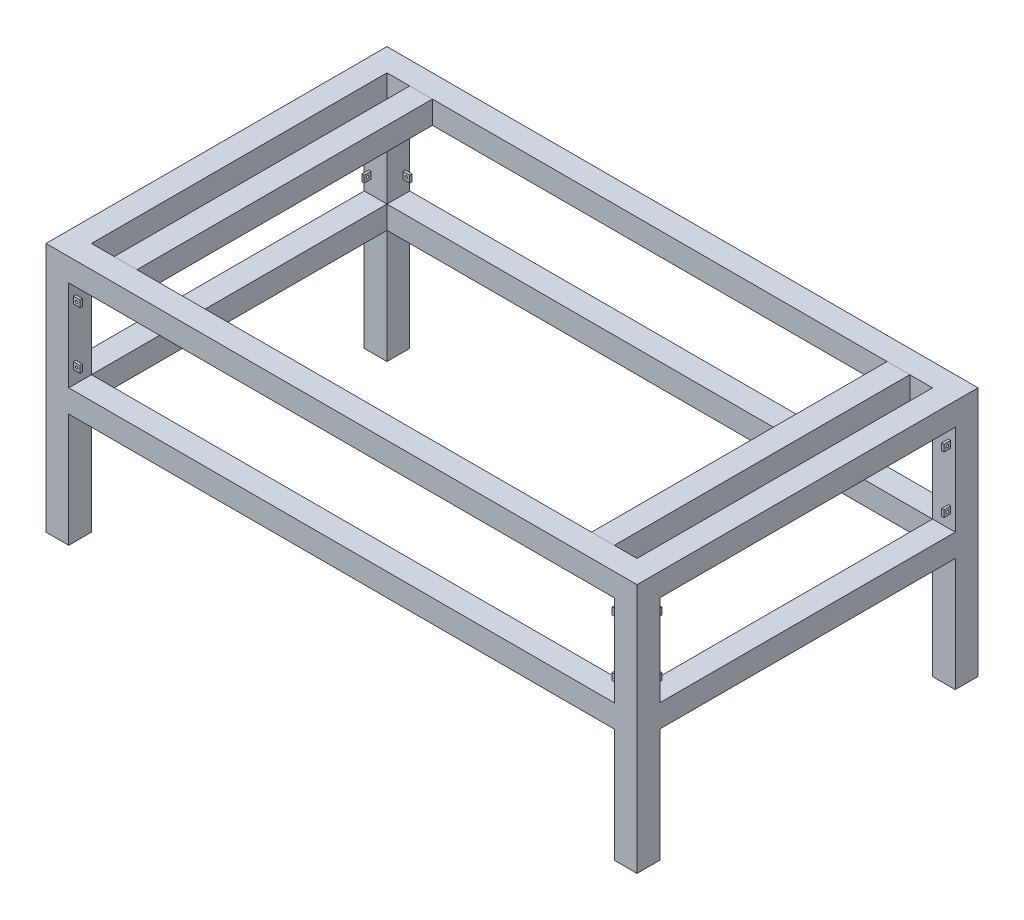
from build123d import *

# Parameters (mm, degrees)
ESQUISSE1_W             = 1300
ESQUISSE1_H             = 750
ESQUISSE1_W_2           = 1200
ESQUISSE1_H_2           = 650
BOSS_EXTRU_1_DEPTH      = 550
ESQUISSE2_W             = 1200
ESQUISSE2_H             = 200
ESQUISSE2_H_2           = 250
ENL_V_MAT_EXTRU_1_DEPTH = 1599.436736315
ESQUISSE3_W             = 650
ESQUISSE3_H             = 200
ESQUISSE3_H_2           = 250
ENL_V_MAT_EXTRU_2_DEPTH = 1599.436736315
ESQUISSE4_W             = 50
ESQUISSE4_H             = 650
BOSS_EXTRU_2_DEPTH      = 50
BOSS_EXTRU_2_2_DEPTH    = 50
ESQUISSE5_W             = 5
ESQUISSE5_H             = 15
BOSS_EXTRU_3_DEPTH      = 15
ESQUISSE6_W             = 5
ESQUISSE6_H             = 15
BOSS_EXTRU_4_DEPTH      = 15
ESQUISSE7_W             = 5
ESQUISSE7_H             = 15
BOSS_EXTRU_5_DEPTH      = 15
ESQUISSE8_W             = 5
ESQUISSE8_H             = 15
BOSS_EXTRU_6_DEPTH      = 15
ESQUISSE10_W            = 5
ESQUISSE10_H            = 15
BOSS_EXTRU_7_DEPTH      = 15
ESQUISSE12_W            = 5
ESQUISSE12_H            = 15
BOSS_EXTRU_8_DEPTH      = 15
ESQUISSE14_W            = 5
ESQUISSE14_H            = 15
BOSS_EXTRU_9_DEPTH      = 15
ESQUISSE15_W            = 5
ESQUISSE15_H            = 15
BOSS_EXTRU_10_DEPTH     = 15
ESQUISSE16_R            = 2.75
ENL_V_MAT_EXTRU_3_DEPTH = 1500
ESQUISSE17_R            = 2.75
ENL_V_MAT_EXTRU_4_DEPTH = 1000


with BuildPart() as part:
    # Esquisse1 → Boss.-Extru.1 (new body)
    with BuildSketch(Plane(origin=(0, 0, 0), x_dir=(1, 0, 0), z_dir=(0, 1, 0))):
        with Locations((650, 375)):
            Rectangle(ESQUISSE1_W, ESQUISSE1_H)
        with Locations((650, 375)):
            Rectangle(ESQUISSE1_W_2, ESQUISSE1_H_2, mode=Mode.SUBTRACT)
    extrude(amount=-BOSS_EXTRU_1_DEPTH)

    # Esquisse2 → Enlèv. mat.-Extru.1 (cut, through all)
    with BuildSketch(Plane.XY):
        with Locations((650, -150)):
            Rectangle(ESQUISSE2_W, ESQUISSE2_H)
        with Locations((650, -425)):
            Rectangle(ESQUISSE2_W, ESQUISSE2_H_2)
    extrude(amount=-ENL_V_MAT_EXTRU_1_DEPTH, mode=Mode.SUBTRACT)

    # Esquisse3 → Enlèv. mat.-Extru.2 (cut, through all)
    with BuildSketch(Plane.ZY):
        with Locations((-375, -150)):
            Rectangle(ESQUISSE3_W, ESQUISSE3_H)
        with Locations((-375, -425)):
            Rectangle(ESQUISSE3_W, ESQUISSE3_H_2)
    extrude(amount=-ENL_V_MAT_EXTRU_2_DEPTH, mode=Mode.SUBTRACT)

    # Esquisse5 → Boss.-Extru.3 (add)
    with BuildSketch(Plane.ZY.offset(-1250)):
        with Locations((-737.5, -87.5)):
            Rectangle(ESQUISSE5_W, ESQUISSE5_H)
        with Locations((-737.5, -212.5)):
            Rectangle(ESQUISSE5_W, ESQUISSE5_H)
    extrude(amount=BOSS_EXTRU_3_DEPTH)

    # Esquisse6 → Boss.-Extru.4 (add)
    with BuildSketch(Plane.XY.offset(-700)):
        with Locations((1287.5, -87.5)):
            Rectangle(ESQUISSE6_W, ESQUISSE6_H)
        with Locations((1287.5, -212.5)):
            Rectangle(ESQUISSE6_W, ESQUISSE6_H)
    extrude(amount=BOSS_EXTRU_4_DEPTH)

    # Esquisse7 → Boss.-Extru.5 (add)
    with BuildSketch(Plane(origin=(50, 0, 0), x_dir=(0, 0, -1), z_dir=(1, 0, 0))):
        with Locations((737.5, -87.5)):
            Rectangle(ESQUISSE7_W, ESQUISSE7_H)
        with Locations((737.5, -212.5)):
            Rectangle(ESQUISSE7_W, ESQUISSE7_H)
    extrude(amount=BOSS_EXTRU_5_DEPTH)

    # Esquisse8 → Boss.-Extru.6 (add)
    with BuildSketch(Plane.XY.offset(-700)):
        with Locations((12.5, -87.5)):
            Rectangle(ESQUISSE8_W, ESQUISSE8_H)
        with Locations((12.5, -212.5)):
            Rectangle(ESQUISSE8_W, ESQUISSE8_H)
    extrude(amount=BOSS_EXTRU_6_DEPTH)

    # Esquisse10 → Boss.-Extru.7 (add)
    with BuildSketch(Plane(origin=(50, 0, 0), x_dir=(0, 0, -1), z_dir=(1, 0, 0))):
        with Locations((12.5, -87.5)):
            Rectangle(ESQUISSE10_W, ESQUISSE10_H)
        with Locations((12.5, -212.5)):
            Rectangle(ESQUISSE10_W, ESQUISSE10_H)
    extrude(amount=BOSS_EXTRU_7_DEPTH)

    # Esquisse12 → Boss.-Extru.8 (add)
    with BuildSketch(Plane(origin=(0, 0, -50), x_dir=(-1, 0, 0), z_dir=(0, 0, -1))):
        with Locations((-12.5, -87.5)):
            Rectangle(ESQUISSE12_W, ESQUISSE12_H)
        with Locations((-12.5, -212.5)):
            Rectangle(ESQUISSE12_W, ESQUISSE12_H)
    extrude(amount=BOSS_EXTRU_8_DEPTH)

    # Esquisse14 → Boss.-Extru.9 (add)
    with BuildSketch(Plane.ZY.offset(-1250)):
        with Locations((-12.5, -87.5)):
            Rectangle(ESQUISSE14_W, ESQUISSE14_H)
        with Locations((-12.5, -212.5)):
            Rectangle(ESQUISSE14_W, ESQUISSE14_H)
    extrude(amount=BOSS_EXTRU_9_DEPTH)

    # Esquisse15 → Boss.-Extru.10 (add)
    with BuildSketch(Plane(origin=(0, 0, -50), x_dir=(-1, 0, 0), z_dir=(0, 0, -1))):
        with Locations((-1287.5, -212.5)):
            Rectangle(ESQUISSE15_W, ESQUISSE15_H)
        with Locations((-1287.5, -87.5)):
            Rectangle(ESQUISSE15_W, ESQUISSE15_H)
    extrude(amount=BOSS_EXTRU_10_DEPTH)

    # Esquisse16 → Enlèv. mat.-Extru.3 (cut)
    with BuildSketch(Plane(origin=(1290, 0, 0), x_dir=(0, 0, -1), z_dir=(1, 0, 0))):
        with Locations((57.5, -87.5)):
            Circle(ESQUISSE16_R)
        with Locations((57.5, -212.5)):
            Circle(ESQUISSE16_R)
        with Locations(Location((692.5, -87.5, 0), (0, 0, 90))):
            Circle(ESQUISSE16_R)
        with Locations(Location((692.5, -212.5, 0), (0, 0, 90))):
            Circle(ESQUISSE16_R)
    extrude(amount=-ENL_V_MAT_EXTRU_3_DEPTH, mode=Mode.SUBTRACT)

    # Esquisse17 → Enlèv. mat.-Extru.4 (cut)
    with BuildSketch(Plane.XY.offset(-10)):
        with Locations((57.5, -87.5)):
            Circle(ESQUISSE17_R)
        with Locations((57.5, -212.5)):
            Circle(ESQUISSE17_R)
        with Locations((1242.5, -212.5)):
            Circle(ESQUISSE17_R)
        with Locations((1242.5, -87.5)):
            Circle(ESQUISSE17_R)
    extrude(amount=-ENL_V_MAT_EXTRU_4_DEPTH, mode=Mode.SUBTRACT)


with BuildPart() as body_2:
    # Esquisse4 → Boss.-Extru.2 (new body)
    with BuildSketch(Plane(origin=(0, 0, 0), x_dir=(1, 0, 0), z_dir=(0, 1, 0))):
        with Locations((125, 375)):
            Rectangle(ESQUISSE4_W, ESQUISSE4_H)
    extrude(amount=-BOSS_EXTRU_2_DEPTH)


with BuildPart() as body_3:
    # Esquisse4 → Boss.-Extru.2 2 (new body)
    with BuildSketch(Plane(origin=(0, 0, 0), x_dir=(1, 0, 0), z_dir=(0, 1, 0))):
        with Locations((1175, 375)):
            Rectangle(ESQUISSE4_W, ESQUISSE4_H)
    extrude(amount=-BOSS_EXTRU_2_2_DEPTH)


solid = Compound([part.part, body_2.part, body_3.part])
